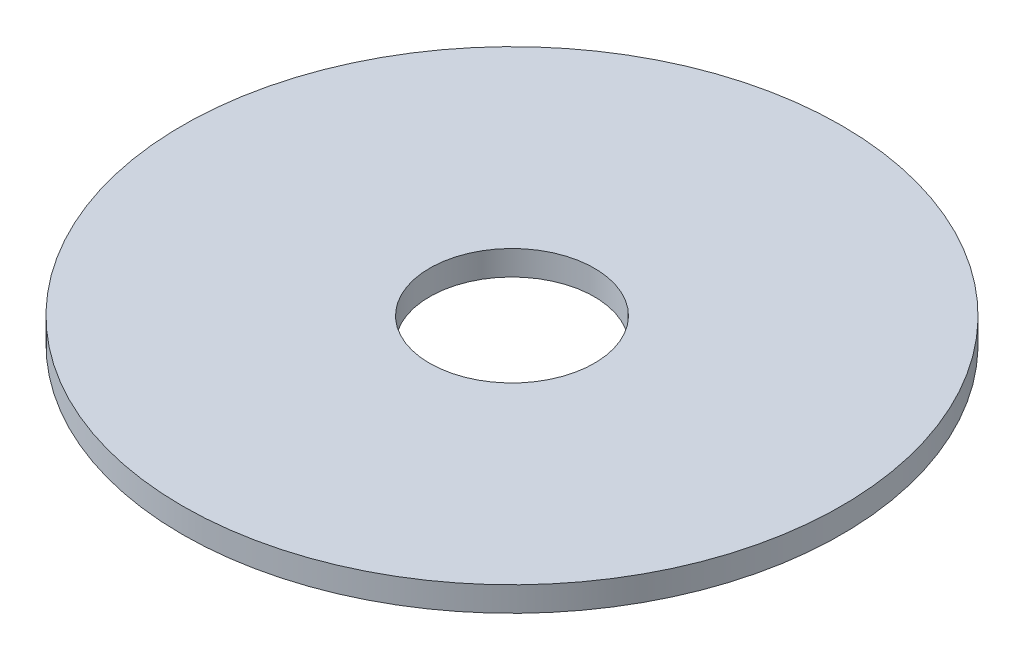
from build123d import *

# Parameters (mm, degrees)
SKETCH1_R           = 20
BOSS_EXTRUDE1_DEPTH = 1.5
SKETCH2_R           = 5
CUT_EXTRUDE1_DEPTH  = 1.5


with BuildPart() as part:
    # Sketch1 → Boss-Extrude1 (new body)
    with BuildSketch(Plane(origin=(0, 0, 0), x_dir=(1, 0, 0), z_dir=(0, 1, 0))):
        with Locations(Location((0, 0, 0), (0, 0, 270))):
            Circle(SKETCH1_R)
    extrude(amount=BOSS_EXTRUDE1_DEPTH)

    # Sketch2 → Cut-Extrude1 (cut)
    with BuildSketch(Plane(origin=(0, 1.5, 0), x_dir=(1, 0, 0), z_dir=(0, 1, 0))):
        with Locations(Location((0, 0, 0), (0, 0, 270))):
            Circle(SKETCH2_R)
    extrude(amount=-CUT_EXTRUDE1_DEPTH, mode=Mode.SUBTRACT)


solid = part.part
